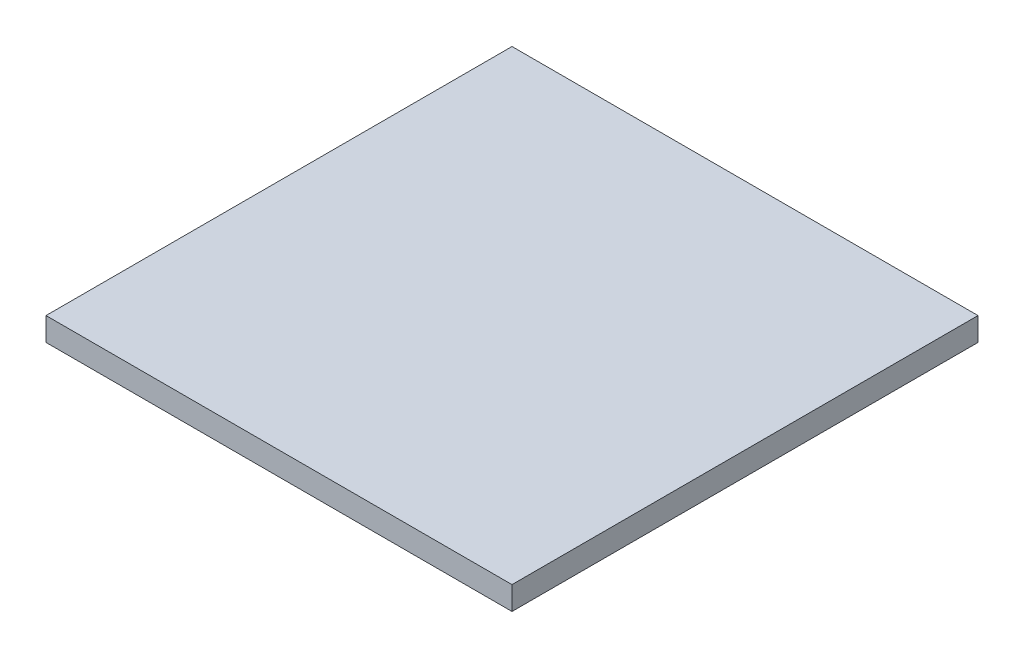
from build123d import *

# Parameters (mm, degrees)
SKETCH2_W           = 400
SKETCH2_H           = 400
BOSS_EXTRUDE1_DEPTH = 20


with BuildPart() as part:
    # Sketch2 → Boss-Extrude1 (new body)
    with BuildSketch(Plane(origin=(0, 0, 0), x_dir=(1, 0, 0), z_dir=(0, 1, 0))):
        Rectangle(SKETCH2_W, SKETCH2_H)
    extrude(amount=BOSS_EXTRUDE1_DEPTH)


solid = part.part
